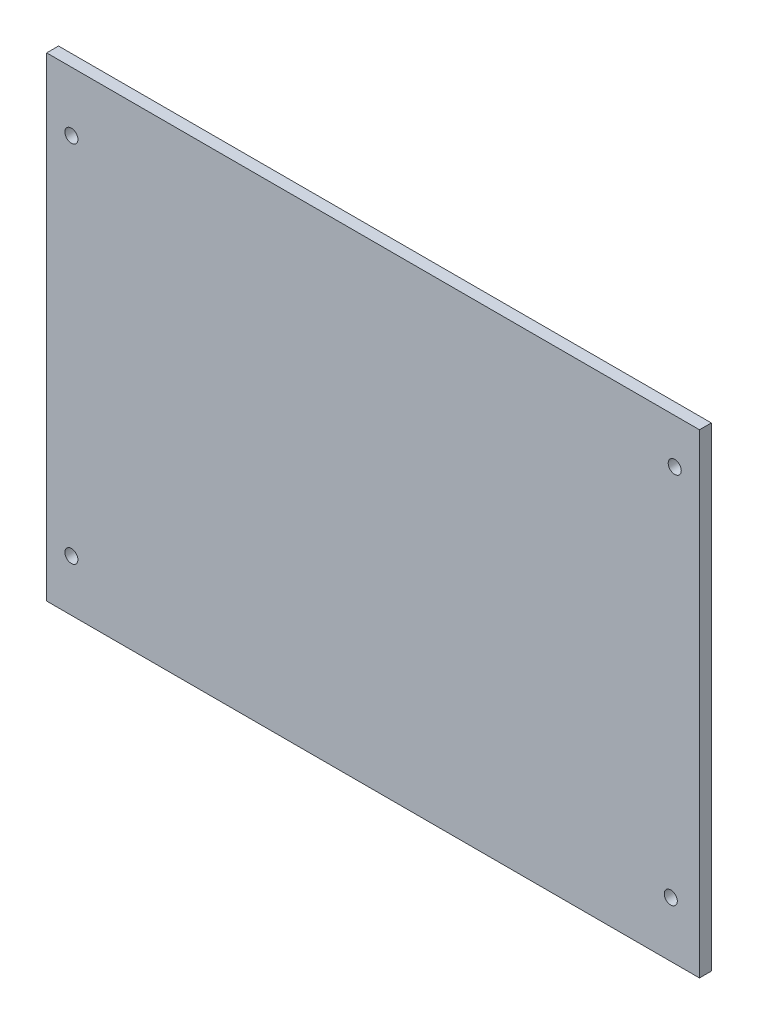
from build123d import *

# Parameters (mm, degrees)
SKETCH_1_W      = 330
SKETCH_1_H      = 240
SKETCH_1_R      = 3.3
EXTRUDE_1_DEPTH = 6


with BuildPart() as part:
    # 草图1 → 凸台-拉伸1 (new body)
    with BuildSketch(Plane.XY):
        with Locations((165, -120)):
            Rectangle(SKETCH_1_W, SKETCH_1_H)
        with Locations((12.5, -30)):
            Circle(SKETCH_1_R, mode=Mode.SUBTRACT)
        with Locations((315.493399268, -212)):
            Circle(SKETCH_1_R, mode=Mode.SUBTRACT)
        with Locations((12.5, -214)):
            Circle(SKETCH_1_R, mode=Mode.SUBTRACT)
        with Locations((317.493399268, -22.5)):
            Circle(SKETCH_1_R, mode=Mode.SUBTRACT)
    extrude(amount=EXTRUDE_1_DEPTH)


solid = part.part
